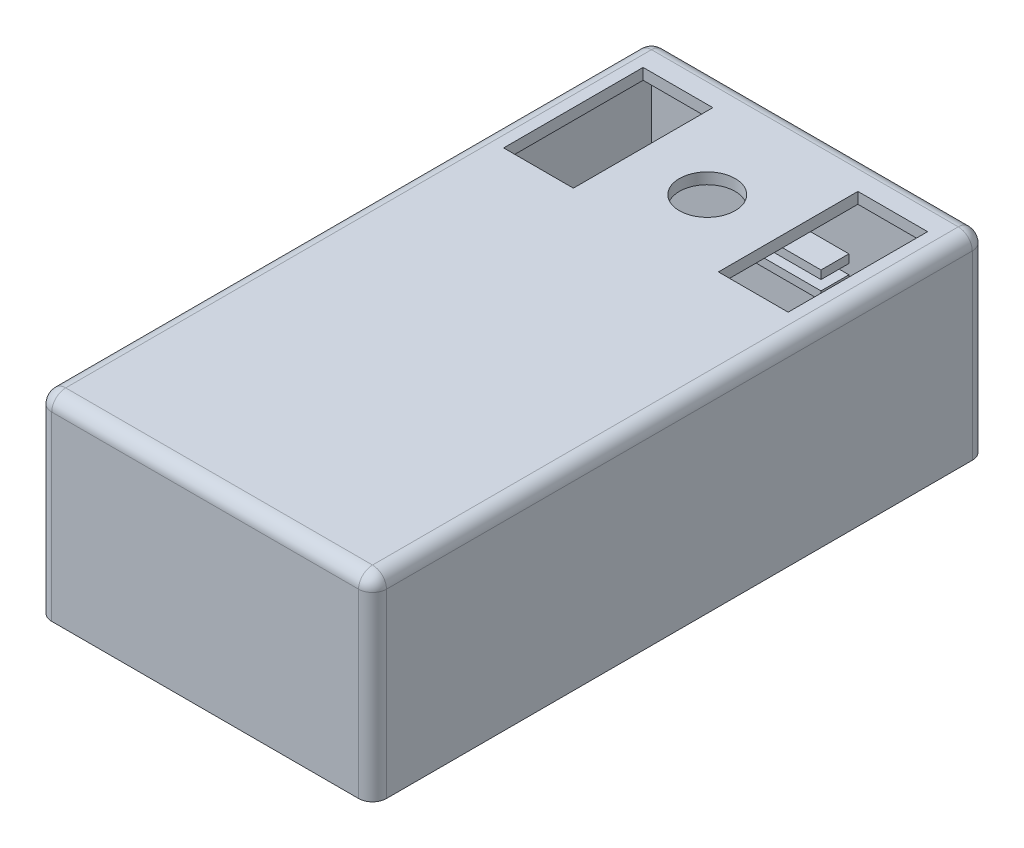
from build123d import *

# Parameters (mm, degrees)
SKETCH1_W           = 60
SKETCH1_H           = 110
BOSS_EXTRUDE1_DEPTH = 35
SKETCH2_W           = 56
SKETCH2_H           = 106
CUT_EXTRUDE1_DEPTH  = 33
SKETCH3_R           = 1.5
BOSS_EXTRUDE2_DEPTH = 36
CUT_EXTRUDE2_DEPTH  = 21
SKETCH6_R           = 5
CUT_EXTRUDE3_DEPTH  = 21
SKETCH7_W           = 8
SKETCH7_H           = 3.25
CUT_EXTRUDE4_DEPTH  = 21
SKETCH8_W           = 13
SKETCH8_H           = 1
CUT_EXTRUDE5_DEPTH  = 3.25
FILLET1_R           = 2.5
SKETCH9_W           = 6
SKETCH9_H           = 8
BOSS_EXTRUDE3_DEPTH = 5
SKETCH10_W          = 18
SKETCH10_H          = 20
CUT_EXTRUDE6_DEPTH  = 1.35
SKETCH11_W          = 4.702418378
SKETCH11_H          = 7.605650594
CUT_EXTRUDE7_DEPTH  = 1.35
SKETCH13_W          = 15
SKETCH13_H          = 1.5
BOSS_EXTRUDE4_DEPTH = 5
CHAMFER1_SIZE       = 2
CUT_EXTRUDE9_START  = -5
SKETCH14_W          = 1
SKETCH14_H          = 3
CUT_EXTRUDE9_DEPTH  = 5


with BuildPart() as part:
    # Sketch1 → Boss-Extrude1 (new body)
    with BuildSketch(Plane(origin=(0, 0, 0), x_dir=(1, 0, 0), z_dir=(0, 1, 0))):
        with Locations((30, 55)):
            Rectangle(SKETCH1_W, SKETCH1_H)
    extrude(amount=BOSS_EXTRUDE1_DEPTH)

    # Sketch2 → Cut-Extrude1 (cut)
    with BuildSketch(Plane.XZ):
        with Locations((30, -55)):
            Rectangle(SKETCH2_W, SKETCH2_H)
    extrude(amount=-CUT_EXTRUDE1_DEPTH, mode=Mode.SUBTRACT)

    # Sketch3 → Boss-Extrude2 (add)
    with BuildSketch(Plane.XZ.offset(-33)):
        with Locations(Location((7.5, -7.5, 0), (0, 0, 270))):
            Circle(SKETCH3_R)
        with Locations(Location((52.5, -7.5, 0), (0, 0, 270))):
            Circle(SKETCH3_R)
        with Locations(Location((7.5, -72.5, 0), (0, 0, 270))):
            Circle(SKETCH3_R)
        with Locations(Location((52.5, -72.5, 0), (0, 0, 270))):
            Circle(SKETCH3_R)
    extrude(amount=BOSS_EXTRUDE2_DEPTH)

    # Sketch4 → Cut-Extrude2 (cut)
    with BuildSketch(Plane(origin=(0, 35, 0), x_dir=(1, 0, 0), z_dir=(0, 1, 0))):
        Polygon((4.5, 104), (17, 104), (17, 85.965044769), (17, 79), (4.5, 79), align=None)
        Polygon((43, 104), (55.5, 104), (55.5, 79), (43, 79), (43, 85.965044769), align=None)
    extrude(amount=-CUT_EXTRUDE2_DEPTH, mode=Mode.SUBTRACT)

    # Sketch6 → Cut-Extrude3 (cut)
    with BuildSketch(Plane(origin=(0, 35, 0), x_dir=(1, 0, 0), z_dir=(0, 1, 0))):
        with Locations(Location((30, 90, 0), (0, 0, 270))):
            Circle(SKETCH6_R)
    extrude(amount=-CUT_EXTRUDE3_DEPTH, mode=Mode.SUBTRACT)

    # Sketch7 → Cut-Extrude4 (cut)
    with BuildSketch(Plane(origin=(0, 0, -110), x_dir=(-1, 0, 0), z_dir=(0, 0, -1))):
        with Locations((-30, 1.625)):
            Rectangle(SKETCH7_W, SKETCH7_H)
    extrude(amount=-CUT_EXTRUDE4_DEPTH, mode=Mode.SUBTRACT)

    # Sketch8 → Cut-Extrude5 (cut)
    with BuildSketch(Plane.XZ):
        with Locations((30, -108.5)):
            Rectangle(SKETCH8_W, SKETCH8_H)
    extrude(amount=-CUT_EXTRUDE5_DEPTH, mode=Mode.SUBTRACT)

    # Fillet1
    fillet1_edges = [part.edges().sort_by_distance(p)[0] for p in [
        (60, 35, -55),
        (30, 35, -110),
        (0, 35, -55),
        (0, 17.5, -110),
        (60, 17.5, -110),
        (60, 17.5, 0),
        (0, 17.5, 0),
        (30, 35, 0),
    ]]
    fillet(fillet1_edges, radius=FILLET1_R)

    # Sketch9 → Boss-Extrude3 (add)
    with BuildSketch(Plane.XZ.offset(-33)):
        Polygon((19.5, -10.111573996), (19.5, -16.111573996), (24.5, -16.111573996), (24.5, -13.111573996), (34.5, -13.111573996), (34.5, -18.111573996), (40.5, -18.111573996), (40.5, -10.111573996), align=None)
        with Locations((37.5, -28.111573996)):
            Rectangle(SKETCH9_W, SKETCH9_H)
    extrude(amount=BOSS_EXTRUDE3_DEPTH)

    # Sketch10 → Cut-Extrude6 (cut)
    with BuildSketch(Plane(origin=(0, 29, 0), x_dir=(-1, 0, 0), z_dir=(0, -1, 0))):
        with Locations((-29.5, 21.111573996)):
            Rectangle(SKETCH10_W, SKETCH10_H)
    extrude(amount=-CUT_EXTRUDE6_DEPTH, mode=Mode.SUBTRACT)

    # Sketch11 → Cut-Extrude7 (cut)
    with BuildSketch(Plane.XZ.offset(-30.35)):
        with Locations((19.397015068, -14.914399293)):
            Rectangle(SKETCH11_W, SKETCH11_H)
    extrude(amount=CUT_EXTRUDE7_DEPTH, mode=Mode.SUBTRACT)

    # Sketch13 → Boss-Extrude4 (add)
    with BuildSketch(Plane.XY.offset(-108)):
        with Locations((29.888929183, 19.75)):
            Rectangle(SKETCH13_W, SKETCH13_H)
        with Locations((29.888929183, 16.5)):
            Rectangle(SKETCH13_W, SKETCH13_H)
    extrude(amount=BOSS_EXTRUDE4_DEPTH)

    # Chamfer1
    chamfer1_edges = [part.edges().sort_by_distance(p)[0] for p in [
        (29.888929183, 15.75, -108),
    ]]
    chamfer(chamfer1_edges, length=CHAMFER1_SIZE)

    # Sketch14 → Cut-Extrude9 (cut)
    with BuildSketch(Plane.XZ.offset(-28).offset(CUT_EXTRUDE9_START)):
        with Locations((24, -14.611573996)):
            Rectangle(SKETCH14_W, SKETCH14_H)
    extrude(amount=CUT_EXTRUDE9_DEPTH, mode=Mode.SUBTRACT)


solid = part.part
